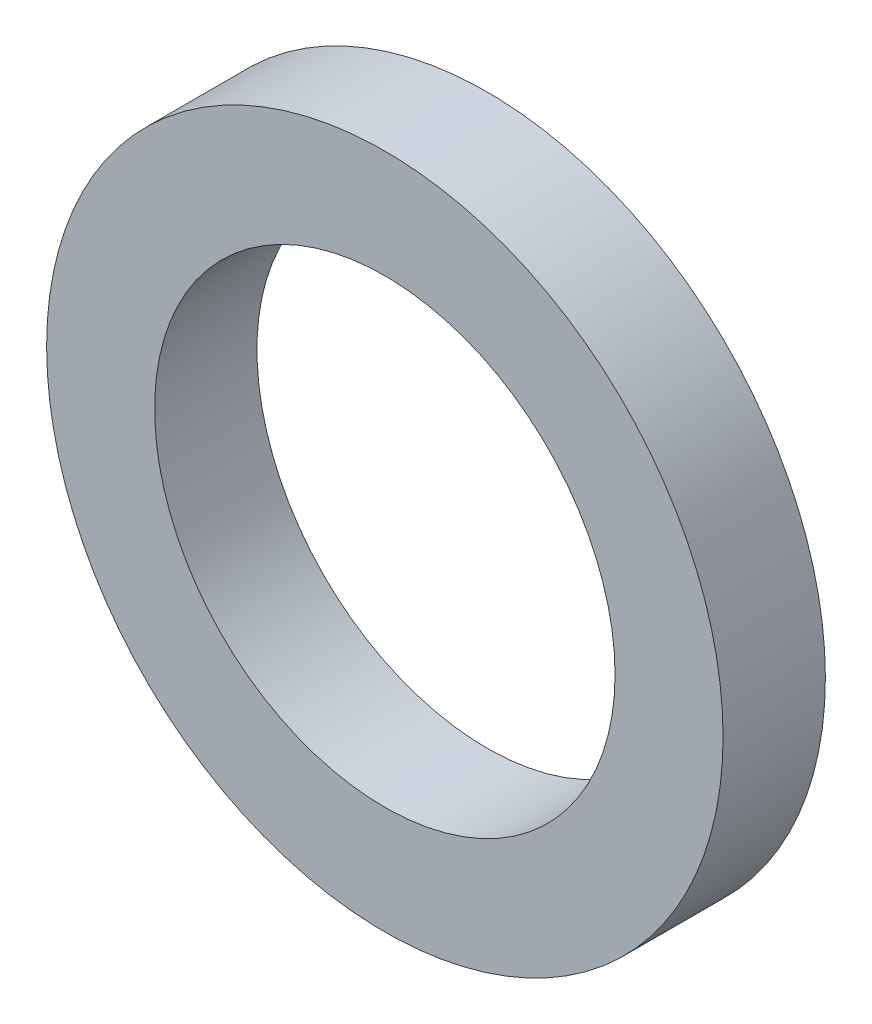
from build123d import *

# Parameters (mm, degrees)
SKETCH1_R           = 188.9125
SKETCH1_R_2         = 128.5875
BOSS_EXTRUDE1_DEPTH = 28.575


with BuildPart() as part:
    # Sketch1 → Boss-Extrude1 (new, symmetric)
    with BuildSketch(Plane(origin=(0, 0, 0), x_dir=(0, 1, 0), z_dir=(0, 0, 1))):
        with Locations(Location((0, 0, 0), (0, 0, 270))):
            Circle(SKETCH1_R)
        with Locations(Location((0, 0, 0), (0, 0, 270))):
            Circle(SKETCH1_R_2, mode=Mode.SUBTRACT)
    extrude(amount=BOSS_EXTRUDE1_DEPTH, both=True)


solid = part.part
